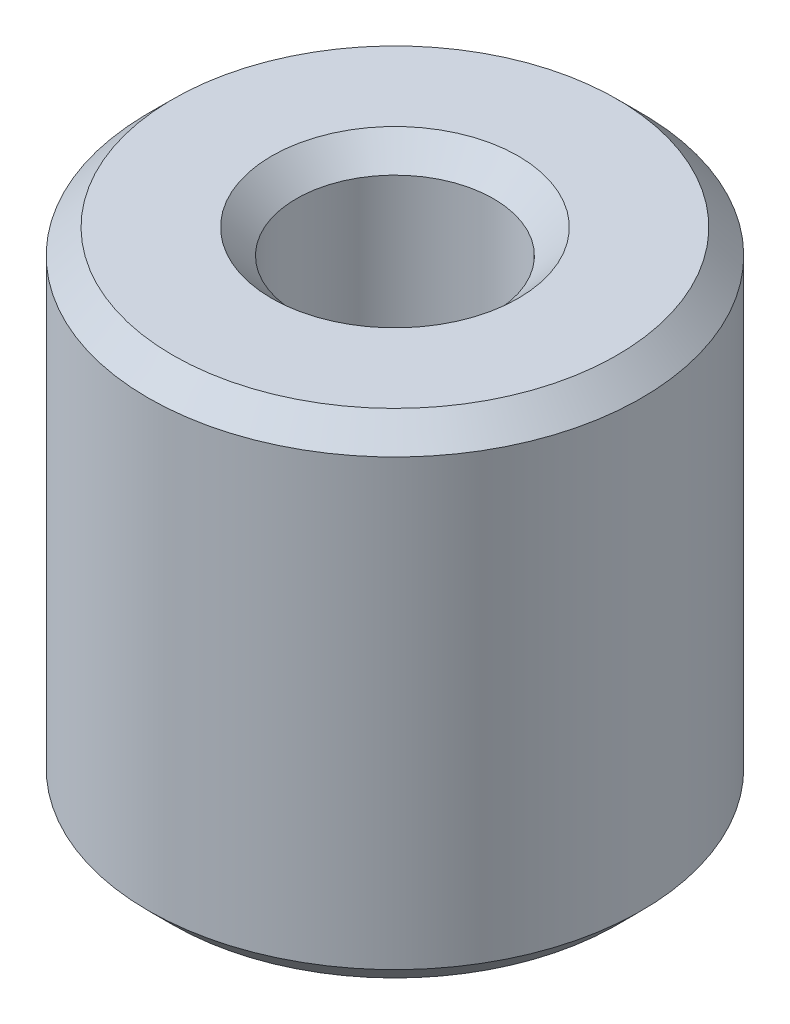
from build123d import *

# Parameters (mm, degrees)
SKETCH1_R           = 4
SKETCH1_R_2         = 1.6
BOSS_EXTRUDE1_DEPTH = 8
CHAMFER1_SIZE       = 0.4


with BuildPart() as part:
    # Sketch1 → Boss-Extrude1 (new body)
    with BuildSketch(Plane(origin=(0, 0, 0), x_dir=(1, 0, 0), z_dir=(0, 1, 0))):
        with Locations(Location((0, 0, 0), (0, 0, 270))):
            Circle(SKETCH1_R)
        with Locations(Location((0, 0, 0), (0, 0, 270))):
            Circle(SKETCH1_R_2, mode=Mode.SUBTRACT)
    extrude(amount=BOSS_EXTRUDE1_DEPTH)

    # Chamfer1
    chamfer1_edges = [part.edges().sort_by_distance(p)[0] for p in [
        (0, 0, -4),
        (0, 8, -4),
        (0, 0, -1.6),
        (0, 8, -1.6),
    ]]
    chamfer(chamfer1_edges, length=CHAMFER1_SIZE)


solid = part.part
